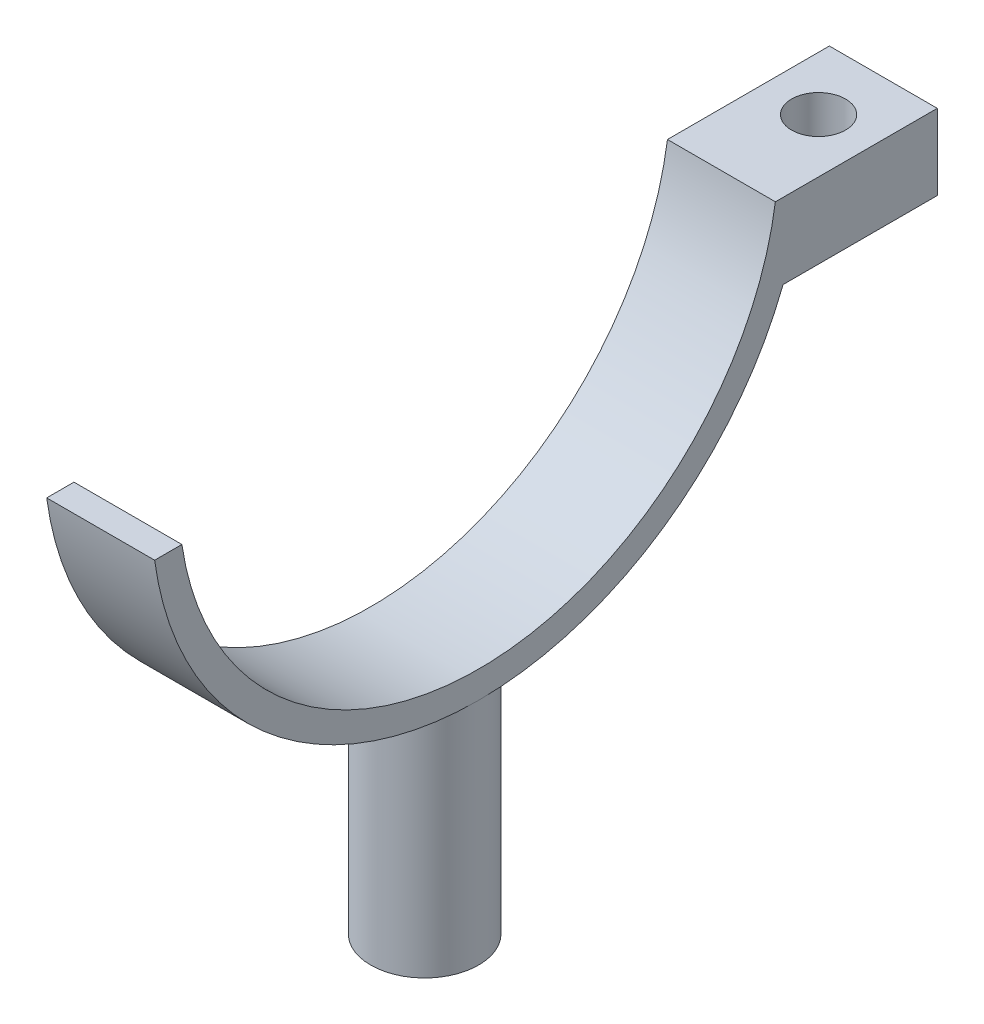
from build123d import *

# Parameters (mm, degrees)
SKETCH1_R           = 5
BOSS_EXTRUDE1_DEPTH = 23.5
BOSS_EXTRUDE2_DEPTH = 5
SKETCH3_W           = 10
SKETCH3_H           = 15
SKETCH3_R           = 2.5
BOSS_EXTRUDE3_DEPTH = 7


with BuildPart() as part:
    # Sketch1 → Boss-Extrude1 (new body)
    with BuildSketch(Plane(origin=(0, 0, 0), x_dir=(1, 0, 0), z_dir=(0, 1, 0))):
        with Locations(Location((0, 0, 0), (0, 0, 270))):
            Circle(SKETCH1_R)
    extrude(amount=BOSS_EXTRUDE1_DEPTH)

    # Sketch2 → Boss-Extrude2 (add, symmetric)
    with BuildSketch(Plane(origin=(0, 0, 0), x_dir=(0, 0, -1), z_dir=(1, 0, 0))):
        with BuildLine():
            Line((-30.017270029, 47.5), (-27.492699031, 47.5))
            ThreePointArc((-27.492699031, 47.5), (0, 23.75), (27.492699031, 47.5))
            Line((27.492699031, 47.5), (30.017270029, 47.5))
            ThreePointArc((30.017270029, 47.5), (0, 21.25), (-30.017270029, 47.5))
        make_face()
    extrude(amount=BOSS_EXTRUDE2_DEPTH, both=True)

    # Sketch3 → Boss-Extrude3 (add)
    with BuildSketch(Plane(origin=(0, 47.5, 0), x_dir=(1, 0, 0), z_dir=(0, 1, 0))):
        with Locations((0, 34.992699031)):
            Rectangle(SKETCH3_W, SKETCH3_H)
        with Locations(Location((0, 36.492699031, 0), (0, 0, 270))):
            Circle(SKETCH3_R, mode=Mode.SUBTRACT)
    extrude(amount=-BOSS_EXTRUDE3_DEPTH)


solid = part.part
